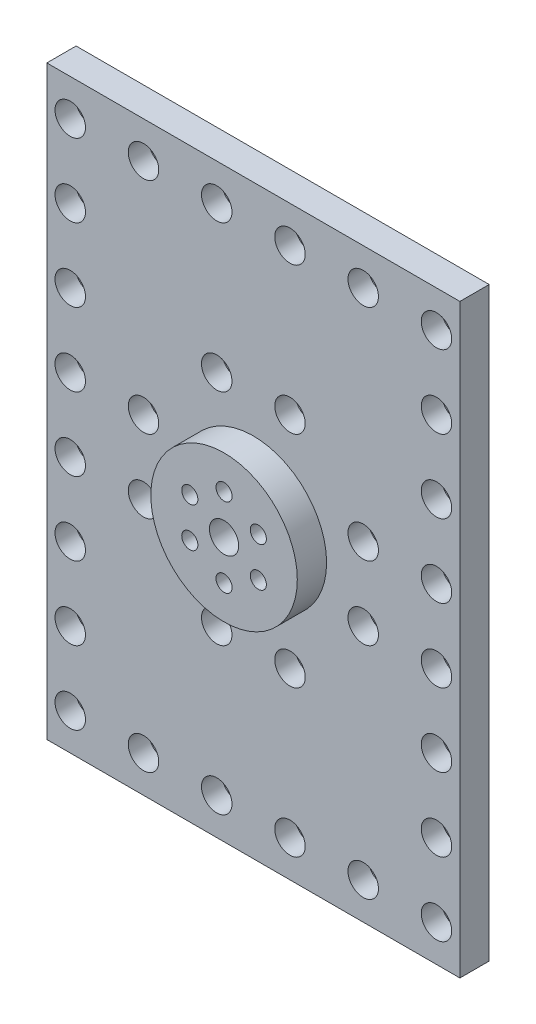
from build123d import *

# Parameters (mm, degrees)
SKETCH_1_W          = 141
SKETCH_1_H          = 200
EXTRUDE_1_DEPTH     = 10
SKETCH_5_R          = 5
SKETCH_5_R_2        = 2.75
CUT_EXTRUDE_5_DEPTH = 245.91018762
SKETCH_6_R          = 5
CUT_EXTRUDE_6_DEPTH = 5
SKETCH_7_R          = 25
EXTRUDE_2_DEPTH     = 10
SKETCH_8_R          = 2.75
SKETCH_8_R_2        = 5
CUT_EXTRUDE_7_DEPTH = 10
SKETCH_9_R          = 3.2
CUT_EXTRUDE_8_DEPTH = 50
SKETCH_10_R         = 5.2
CUT_EXTRUDE_9_DEPTH = 7


with BuildPart() as part:
    # 스케치1 → 보스-돌출1 (new body)
    with BuildSketch(Plane.XY):
        with Locations((-70.5, 100)):
            Rectangle(SKETCH_1_W, SKETCH_1_H)
    extrude(amount=EXTRUDE_1_DEPTH)

    # 스케치5 → 컷-돌출5 (cut, through all)
    with BuildSketch(Plane.XY):
        with Locations((-70.5, 100)):
            Circle(SKETCH_5_R)
        with Locations((-70.5, 113.5)):
            Circle(SKETCH_5_R_2)
        with Locations((-58.808657049, 106.75)):
            Circle(SKETCH_5_R_2)
        with Locations((-58.808657049, 93.25)):
            Circle(SKETCH_5_R_2)
        with Locations((-70.5, 86.5)):
            Circle(SKETCH_5_R_2)
        with Locations((-82.191342951, 93.25)):
            Circle(SKETCH_5_R_2)
        with Locations((-82.191342951, 106.75)):
            Circle(SKETCH_5_R_2)
    extrude(amount=CUT_EXTRUDE_5_DEPTH, mode=Mode.SUBTRACT)

    # 스케치6 → 컷-돌출6 (cut)
    with BuildSketch(Plane(origin=(0, 0, 0), x_dir=(-1, 0, 0), z_dir=(0, 0, -1))):
        with Locations((70.5, 113.5)):
            Circle(SKETCH_6_R)
        with Locations((82.191342951, 106.75)):
            Circle(SKETCH_6_R)
        with Locations((82.191342951, 93.25)):
            Circle(SKETCH_6_R)
        with Locations((70.5, 86.5)):
            Circle(SKETCH_6_R)
        with Locations((58.808657049, 93.25)):
            Circle(SKETCH_6_R)
        with Locations((58.808657049, 106.75)):
            Circle(SKETCH_6_R)
    extrude(amount=-CUT_EXTRUDE_6_DEPTH, mode=Mode.SUBTRACT)

    # 스케치7 → 보스-돌출2 (add)
    with BuildSketch(Plane.XY.offset(10)):
        with Locations((-70.5, 100)):
            Circle(SKETCH_7_R)
    extrude(amount=EXTRUDE_2_DEPTH)

    # 스케치8 → 컷-돌출7 (cut)
    with BuildSketch(Plane(origin=(0, 0, 10), x_dir=(-1, 0, 0), z_dir=(0, 0, -1))):
        with Locations((82.191342951, 106.75)):
            Circle(SKETCH_8_R)
        with Locations((82.191342951, 93.25)):
            Circle(SKETCH_8_R)
        with Locations((70.5, 86.5)):
            Circle(SKETCH_8_R)
        with Locations((58.808657049, 93.25)):
            Circle(SKETCH_8_R)
        with Locations((58.808657049, 106.75)):
            Circle(SKETCH_8_R)
        with Locations((70.5, 113.5)):
            Circle(SKETCH_8_R)
        with Locations((70.5, 100)):
            Circle(SKETCH_8_R_2)
    extrude(amount=-CUT_EXTRUDE_7_DEPTH, mode=Mode.SUBTRACT)

    # 스케치9 → 컷-돌출8 (cut)
    with BuildSketch(Plane.XY.offset(10)):
        with Locations((-8, 187.5)):
            Circle(SKETCH_9_R)
        with Locations((-8, 12.5)):
            Circle(SKETCH_9_R)
        with Locations((-133, 187.5)):
            Circle(SKETCH_9_R)
        with Locations((-133, 12.5)):
            Circle(SKETCH_9_R)
        with Locations((-33, 187.5)):
            Circle(SKETCH_9_R)
        with Locations((-58, 187.5)):
            Circle(SKETCH_9_R)
        with Locations((-83, 187.5)):
            Circle(SKETCH_9_R)
        with Locations((-108, 187.5)):
            Circle(SKETCH_9_R)
        with Locations((-8, 162.5)):
            Circle(SKETCH_9_R)
        with Locations((-8, 137.5)):
            Circle(SKETCH_9_R)
        with Locations((-8, 112.5)):
            Circle(SKETCH_9_R)
        with Locations((-8, 87.5)):
            Circle(SKETCH_9_R)
        with Locations((-8, 62.5)):
            Circle(SKETCH_9_R)
        with Locations((-8, 37.5)):
            Circle(SKETCH_9_R)
        with Locations((-133, 162.5)):
            Circle(SKETCH_9_R)
        with Locations((-133, 137.5)):
            Circle(SKETCH_9_R)
        with Locations((-133, 112.5)):
            Circle(SKETCH_9_R)
        with Locations((-133, 87.5)):
            Circle(SKETCH_9_R)
        with Locations((-133, 62.5)):
            Circle(SKETCH_9_R)
        with Locations((-133, 37.5)):
            Circle(SKETCH_9_R)
        with Locations((-108, 12.5)):
            Circle(SKETCH_9_R)
        with Locations((-83, 12.5)):
            Circle(SKETCH_9_R)
        with Locations((-58, 12.5)):
            Circle(SKETCH_9_R)
        with Locations((-33, 12.5)):
            Circle(SKETCH_9_R)
        with Locations((-33, 112.5)):
            Circle(SKETCH_9_R)
        with Locations((-33, 87.5)):
            Circle(SKETCH_9_R)
        with Locations((-108, 112.5)):
            Circle(SKETCH_9_R)
        with Locations((-108, 87.5)):
            Circle(SKETCH_9_R)
        with Locations((-58, 137.5)):
            Circle(SKETCH_9_R)
        with Locations((-83, 137.5)):
            Circle(SKETCH_9_R)
        with Locations((-58, 62.5)):
            Circle(SKETCH_9_R)
        with Locations((-83, 62.5)):
            Circle(SKETCH_9_R)
    extrude(amount=-CUT_EXTRUDE_8_DEPTH, mode=Mode.SUBTRACT)

    # 스케치10 → 컷-돌출9 (cut)
    with BuildSketch(Plane.XY.offset(10)):
        with Locations((-8, 187.5)):
            Circle(SKETCH_10_R)
        with Locations((-33, 187.5)):
            Circle(SKETCH_10_R)
        with Locations((-58, 187.5)):
            Circle(SKETCH_10_R)
        with Locations((-83, 187.5)):
            Circle(SKETCH_10_R)
        with Locations((-108, 187.5)):
            Circle(SKETCH_10_R)
        with Locations((-133, 187.5)):
            Circle(SKETCH_10_R)
        with Locations((-8, 162.5)):
            Circle(SKETCH_10_R)
        with Locations((-8, 137.5)):
            Circle(SKETCH_10_R)
        with Locations((-8, 112.5)):
            Circle(SKETCH_10_R)
        with Locations((-8, 87.5)):
            Circle(SKETCH_10_R)
        with Locations((-8, 62.5)):
            Circle(SKETCH_10_R)
        with Locations((-8, 37.5)):
            Circle(SKETCH_10_R)
        with Locations((-8, 12.5)):
            Circle(SKETCH_10_R)
        with Locations((-33, 12.5)):
            Circle(SKETCH_10_R)
        with Locations((-58, 12.5)):
            Circle(SKETCH_10_R)
        with Locations((-83, 12.5)):
            Circle(SKETCH_10_R)
        with Locations((-108, 12.5)):
            Circle(SKETCH_10_R)
        with Locations((-133, 12.5)):
            Circle(SKETCH_10_R)
        with Locations((-133, 162.5)):
            Circle(SKETCH_10_R)
        with Locations((-133, 137.5)):
            Circle(SKETCH_10_R)
        with Locations((-133, 112.5)):
            Circle(SKETCH_10_R)
        with Locations((-133, 87.5)):
            Circle(SKETCH_10_R)
        with Locations((-133, 62.5)):
            Circle(SKETCH_10_R)
        with Locations((-133, 37.5)):
            Circle(SKETCH_10_R)
        with Locations((-33, 112.5)):
            Circle(SKETCH_10_R)
        with Locations((-33, 87.5)):
            Circle(SKETCH_10_R)
        with Locations((-58, 62.5)):
            Circle(SKETCH_10_R)
        with Locations((-83, 62.5)):
            Circle(SKETCH_10_R)
        with Locations((-108, 87.5)):
            Circle(SKETCH_10_R)
        with Locations((-108, 112.5)):
            Circle(SKETCH_10_R)
        with Locations((-83, 137.5)):
            Circle(SKETCH_10_R)
        with Locations((-58, 137.5)):
            Circle(SKETCH_10_R)
    extrude(amount=-CUT_EXTRUDE_9_DEPTH, mode=Mode.SUBTRACT)


solid = part.part
